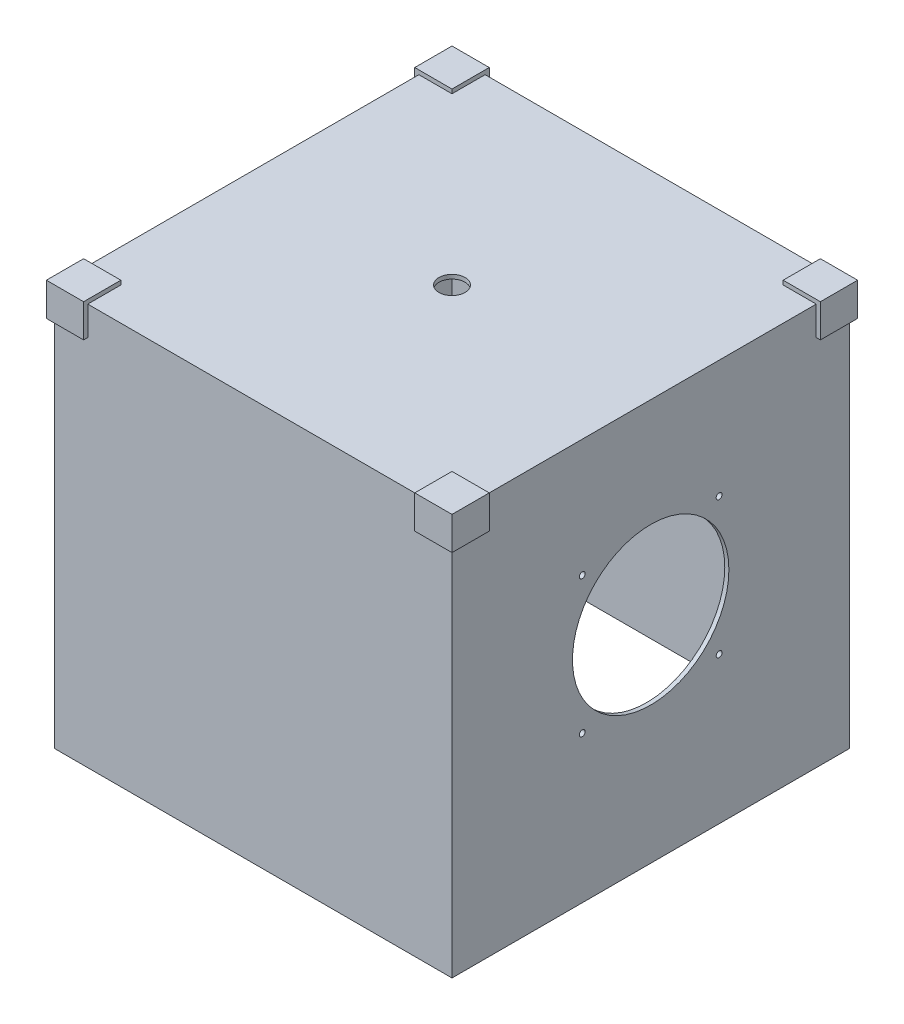
from build123d import *

# Parameters (mm, degrees)
SKETCH1_W               = 304.8
SKETCH1_H               = 304.8
SKETCH1_R               = 10
BOSS_EXTRUDE1_DEPTH     = 3.175
SKETCH1_3_W             = 304.8
SKETCH1_3_H             = 304.8
SKETCH1_3_W_2           = 298.45
SKETCH1_3_H_2           = 298.45
BOSS_EXTRUDE2_DEPTH     = 307.975
SKETCH3_W               = 25.4
SKETCH3_H               = 25.4
BOSS_EXTRUDE3_DEPTH     = 3.175
BOSS_EXTRUDE4_START     = -22.225
BOSS_EXTRUDE4_DEPTH     = 25.4
CIRPATTERN1_COUNT       = 4
BOSS_EXTRUDE5_DEPTH     = 25.4
CIRPATTERN2_COUNT       = 4
CUT_EXTRUDE1_DEPTH      = 461.385948146
CUT_EXTRUDE1_DEPTH_BACK = 461.385948146
SKETCH6_R               = 60
SKETCH6_R_2             = 2.25


with BuildPart() as part:
    # Sketch1 → Boss-Extrude1 (new body)
    with BuildSketch(Plane(origin=(0, 0, 0), x_dir=(1, 0, 0), z_dir=(0, 1, 0))):
        Rectangle(SKETCH1_W, SKETCH1_H)
        Circle(SKETCH1_R, mode=Mode.SUBTRACT)
    extrude(amount=-BOSS_EXTRUDE1_DEPTH)

    # Sketch1<3> → Boss-Extrude2 (add)
    with BuildSketch(Plane(origin=(0, 0, 0), x_dir=(1, 0, 0), z_dir=(0, 1, 0))):
        Rectangle(SKETCH1_3_W, SKETCH1_3_H)
        Rectangle(SKETCH1_3_W_2, SKETCH1_3_H_2, mode=Mode.SUBTRACT)
    extrude(amount=-BOSS_EXTRUDE2_DEPTH)

    # Sketch3 → Boss-Extrude3 (add)
    with BuildSketch(Plane(origin=(0, 0, 0), x_dir=(1, 0, 0), z_dir=(0, 1, 0))):
        with Locations((-139.7, 139.7)):
            Rectangle(SKETCH3_W, SKETCH3_H)
    boss_extrude3 = extrude(amount=BOSS_EXTRUDE3_DEPTH)

    # Sketch3<3> → Boss-Extrude4 (add)
    with BuildSketch(Plane(origin=(0, 0, 0), x_dir=(1, 0, 0), z_dir=(0, 1, 0)).offset(BOSS_EXTRUDE4_START)):
        Polygon((-152.4, 127), (-152.4, 152.4), (-127, 152.4), (-127, 155.575), (-155.575, 155.575), (-155.575, 127), align=None)
    boss_extrude4 = extrude(amount=BOSS_EXTRUDE4_DEPTH)

    # CirPattern1: Boss-Extrude3, Boss-Extrude4 ×4 about axis
    cirpattern1_axis = Axis((0, 0, 0), (0, 1, 0))
    add([boss_extrude3.rotate(cirpattern1_axis, i * 360 / CIRPATTERN1_COUNT) for i in range(1, CIRPATTERN1_COUNT)])
    add([boss_extrude4.rotate(cirpattern1_axis, i * 360 / CIRPATTERN1_COUNT) for i in range(1, CIRPATTERN1_COUNT)])

    # Sketch5 → Boss-Extrude5 (add)
    with BuildSketch(Plane.XZ.offset(307.975)):
        Polygon((-149.225, 123.825), (-146.05, 123.825), (-146.05, 146.05), (-123.825, 146.05), (-123.825, 149.225), (-149.225, 149.225), align=None)
    boss_extrude5 = extrude(amount=-BOSS_EXTRUDE5_DEPTH)

    # CirPattern2: Boss-Extrude5 ×4 about axis
    cirpattern2_axis = Axis((0, 0, 0), (0, 1, 0))
    for i in range(1, CIRPATTERN2_COUNT):
        add(boss_extrude5.rotate(cirpattern2_axis, i * 360 / CIRPATTERN2_COUNT))

    # Sketch6 → Cut-Extrude1 (cut, two sides: drawn at the far end of the back side and taken through both)
    with BuildSketch(Plane.ZY.offset(-149.225).offset(-CUT_EXTRUDE1_DEPTH_BACK)):
        with Locations((0, -142.875)):
            Circle(SKETCH6_R)
        with Locations((-52.5, -90.375)):
            Circle(SKETCH6_R_2)
        with Locations((52.5, -90.375)):
            Circle(SKETCH6_R_2)
        with Locations((52.5, -195.375)):
            Circle(SKETCH6_R_2)
        with Locations((-52.5, -195.375)):
            Circle(SKETCH6_R_2)
    extrude(amount=CUT_EXTRUDE1_DEPTH + CUT_EXTRUDE1_DEPTH_BACK, mode=Mode.SUBTRACT)


solid = part.part
